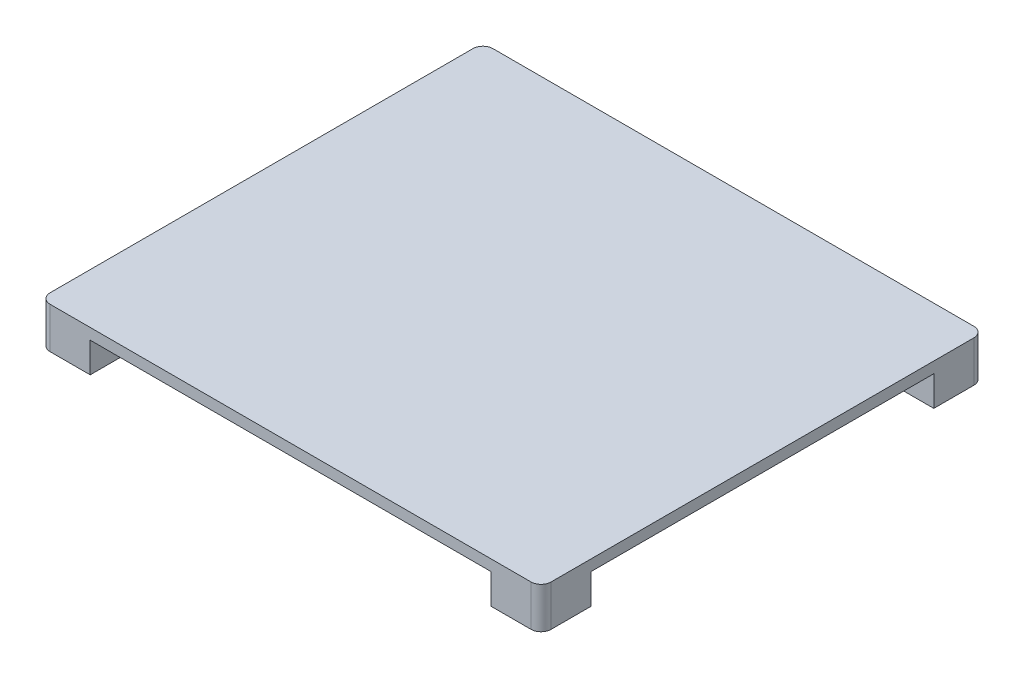
from build123d import *

# Parameters (mm, degrees)
CROQUIS1_W              = 250
CROQUIS1_H              = 221
SALIENTE_EXTRUIR1_DEPTH = 5.5
SALIENTE_EXTRUIR2_DEPTH = 15
CROQUIS3_W              = 150
CROQUIS3_H              = 100
SALIENTE_EXTRUIR3_DEPTH = 15
FILLET1_R               = 5


with BuildPart() as part:
    # Croquis1 → Saliente-Extruir1 (new body)
    with BuildSketch(Plane(origin=(0, 0, 0), x_dir=(1, 0, 0), z_dir=(0, 1, 0))):
        Rectangle(CROQUIS1_W, CROQUIS1_H)
    extrude(amount=SALIENTE_EXTRUIR1_DEPTH)

    # Croquis2 → Saliente-Extruir2 (add)
    with BuildSketch(Plane.XZ):
        Polygon((-125, 110.5), (-100, 110.5), (-100, 90.5), (-105, 90.5), (-105, 85.5), (-125, 85.5), align=None)
        Polygon((125, -110.5), (125, -85.5), (105, -85.5), (105, -90.5), (100, -90.5), (100, -110.5), align=None)
    saliente_extruir2 = extrude(amount=SALIENTE_EXTRUIR2_DEPTH)

    # Simetría1: Saliente-Extruir2 across plane
    add(saliente_extruir2.mirror(Plane.XY))

    # Croquis3 → Saliente-Extruir3 (add)
    with BuildSketch(Plane.XZ):
        Rectangle(CROQUIS3_W, CROQUIS3_H)
    extrude(amount=SALIENTE_EXTRUIR3_DEPTH)

    # Fillet1
    fillet1_edges = [part.edges().sort_by_distance(p)[0] for p in [
        (125, -4.75, 110.5),
        (-125, -4.75, 110.5),
        (-125, -4.75, -110.5),
        (125, -4.75, -110.5),
    ]]
    fillet(fillet1_edges, radius=FILLET1_R)


solid = part.part
